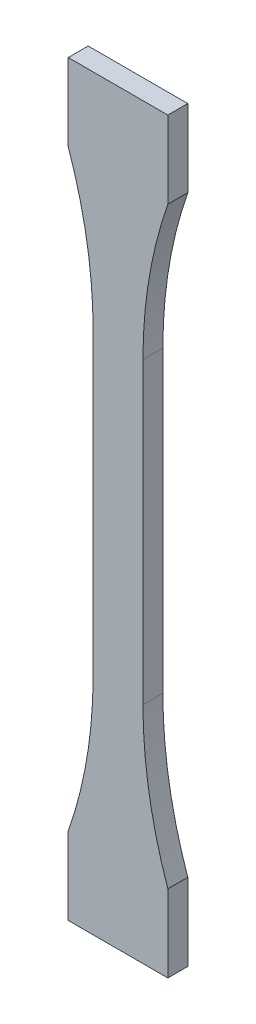
from build123d import *

# Parameters (mm, degrees)
ESQUISSE1_W        = 10
ESQUISSE1_H        = 60
BOSS_EXTRU_1_DEPTH = 4


with BuildPart() as part:
    # Esquisse1 → Boss.-Extru.1 (new body)
    with BuildSketch(Plane.XY):
        with BuildLine():
            Line((-5, 30), (5, 30))
            ThreePointArc((5, 30), (6.258850628, 44.9603643), (10, 59.5))
            Line((10, 59.5), (10, 75))
            Line((10, 75), (-10, 75))
            Line((-10, 75), (-10, 59.5))
            ThreePointArc((-10, 59.5), (-6.258850628, 44.9603643), (-5, 30))
        make_face()
        Rectangle(ESQUISSE1_W, ESQUISSE1_H)
        with BuildLine():
            Line((10, -59.5), (10, -75))
            Line((10, -75), (-10, -75))
            Line((-10, -75), (-10, -59.5))
            ThreePointArc((-10, -59.5), (-6.258850628, -44.9603643), (-5, -30))
            Line((-5, -30), (5, -30))
            ThreePointArc((5, -30), (6.258850628, -44.9603643), (10, -59.5))
        make_face()
    extrude(amount=BOSS_EXTRU_1_DEPTH)


solid = part.part
